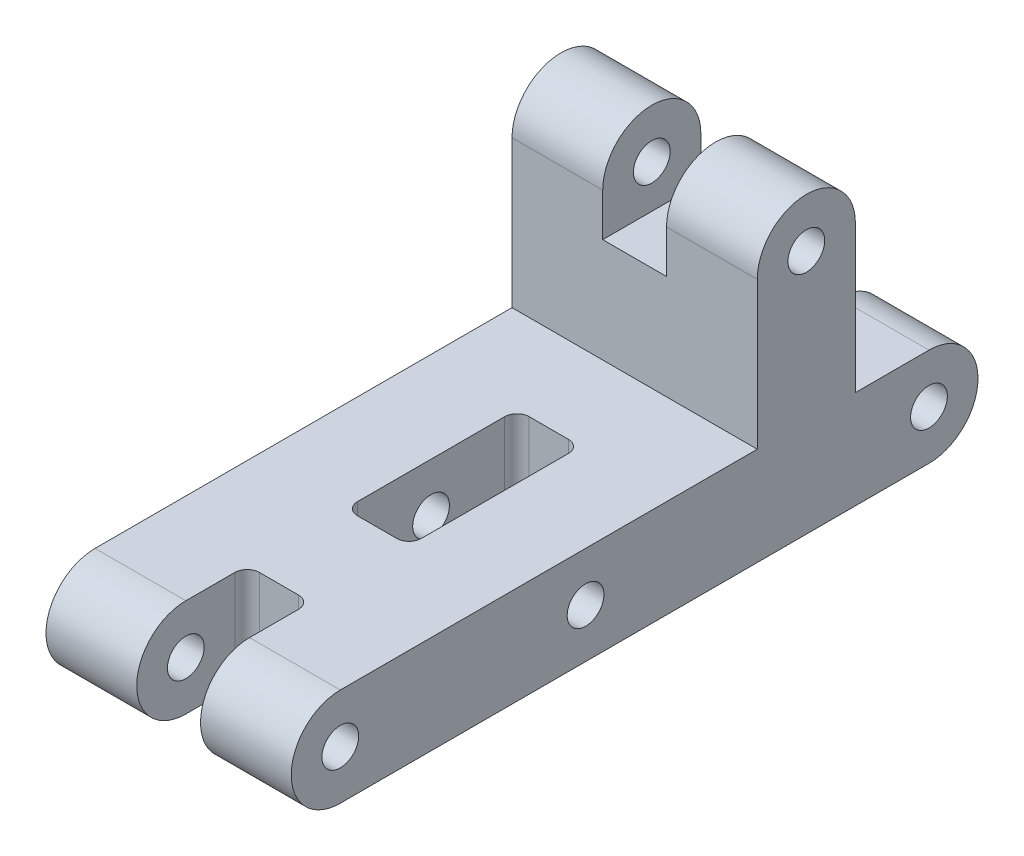
from build123d import *

# Parameters (mm, degrees)
CROQUIS1_R              = 1.5
SALIENTE_EXTRUIR1_DEPTH = 10
CROQUIS2_W              = 8
CROQUIS2_H              = 7.5
CROQUIS2_W_2            = 14
CROQUIS2_H_2            = 8
CROQUIS2_W_3            = 9
CORTAR_EXTRUIR1_DEPTH   = 2.6
REDONDEO1_R             = 1


with BuildPart() as part:
    # Croquis1 → Saliente-Extruir1 (new, symmetric)
    with BuildSketch(Plane(origin=(0, 0, 0), x_dir=(0, 0, -1), z_dir=(1, 0, 0))):
        with BuildLine():
            Line((-14, 4), (0, 4))
            Line((0, 4), (0, 16))
            ThreePointArc((0, 16), (4, 20), (8, 16))
            Line((8, 16), (8, 4))
            Line((8, 4), (14, 4))
            ThreePointArc((14, 4), (18, 0), (14, -4))
            Line((14, -4), (-14, -4))
            Line((-14, -4), (-34, -4))
            ThreePointArc((-34, -4), (-38, 0), (-34, 4))
            Line((-34, 4), (-14, 4))
        make_face()
        with Locations((14, 0)):
            Circle(CROQUIS1_R, mode=Mode.SUBTRACT)
        with Locations((4, 16)):
            Circle(CROQUIS1_R, mode=Mode.SUBTRACT)
        with Locations((-14, 0)):
            Circle(CROQUIS1_R, mode=Mode.SUBTRACT)
        with Locations((-34, 0)):
            Circle(CROQUIS1_R, mode=Mode.SUBTRACT)
    extrude(amount=SALIENTE_EXTRUIR1_DEPTH, both=True)

    # Croquis2 → Cortar-Extruir1 (cut, symmetric)
    with BuildSketch(Plane(origin=(0, 0, 0), x_dir=(0, 0, -1), z_dir=(1, 0, 0))):
        with Locations((4, 16.25)):
            Rectangle(CROQUIS2_W, CROQUIS2_H)
        with Locations((-14, 0)):
            Rectangle(CROQUIS2_W_2, CROQUIS2_H_2)
        with Locations((13.5, 0)):
            Rectangle(CROQUIS2_W_3, CROQUIS2_H_2)
        with Locations((-33.5, 0)):
            Rectangle(CROQUIS2_W_3, CROQUIS2_H_2)
    extrude(amount=CORTAR_EXTRUIR1_DEPTH, both=True, mode=Mode.SUBTRACT)

    # Redondeo1
    redondeo1_edges = [part.edges().sort_by_distance(p)[0] for p in [
        (2.6, 0, -9),
        (-2.6, 0, -9),
        (-2.6, 0, 7),
        (-2.6, 0, 21),
        (2.6, 0, 7),
        (2.6, 0, 21),
        (2.6, 0, 29),
        (-2.6, 0, 29),
    ]]
    fillet(redondeo1_edges, radius=REDONDEO1_R)


solid = part.part
